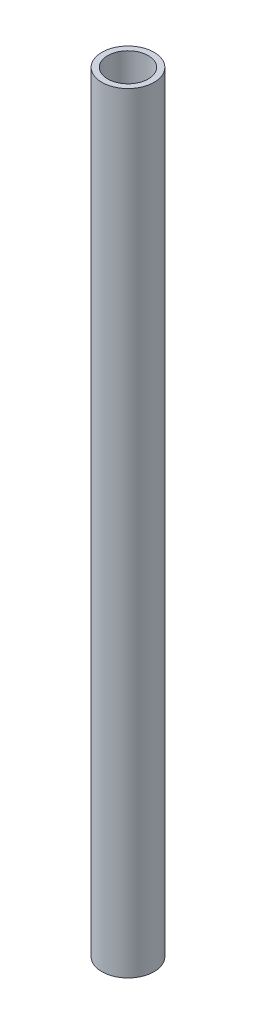
from build123d import *

# Parameters (mm, degrees)
SKETCH1_R           = 9
SKETCH1_R_2         = 7
BOSS_EXTRUDE1_DEPTH = 265.82


with BuildPart() as part:
    # Sketch1 → Boss-Extrude1 (new body)
    with BuildSketch(Plane(origin=(0, 0, 0), x_dir=(1, 0, 0), z_dir=(0, 1, 0))):
        with Locations(Location((0, 0, 0), (0, 0, 270))):
            Circle(SKETCH1_R)
        with Locations(Location((0, 0, 0), (0, 0, 270))):
            Circle(SKETCH1_R_2, mode=Mode.SUBTRACT)
    extrude(amount=BOSS_EXTRUDE1_DEPTH)


solid = part.part
